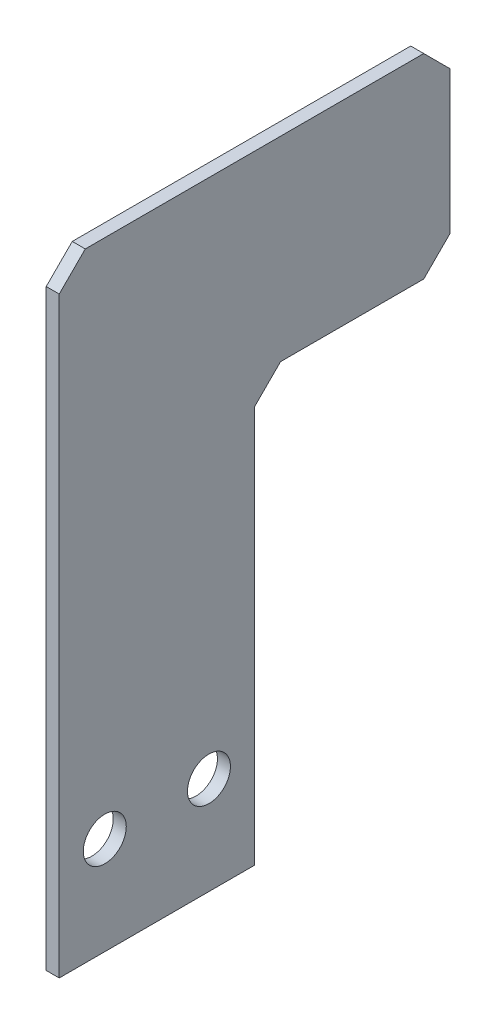
from build123d import *

# Parameters (mm, degrees)
BOSS_EXTRUDE1_DEPTH = 2.54
SKETCH2_R           = 4.191
CUT_EXTRUDE1_DEPTH  = 95.508529347


with BuildPart() as part:
    # Sketch1 → Boss-Extrude1 (new body)
    with BuildSketch(Plane(origin=(0, 0, 0), x_dir=(0, 0, -1), z_dir=(1, 0, 0))):
        Polygon((21.030595238, 39.385119048), (48.970595238, 39.385119048), (54.050595238, 44.465119048), (54.050595238, 72.405119048), (48.970595238, 77.485119048), (-17.069404762, 77.485119048), (-22.149404762, 72.405119048), (-22.149404762, -43.164880952), (15.950595238, -43.164880952), (15.950595238, 34.305119048), align=None)
    extrude(amount=BOSS_EXTRUDE1_DEPTH)

    # Sketch2 → Cut-Extrude1 (cut, through all)
    with BuildSketch(Plane(origin=(2.54, 0, 0), x_dir=(0, 0, -1), z_dir=(1, 0, 0))):
        with Locations((-13.259404762, -24.114880952)):
            Circle(SKETCH2_R)
        with Locations((7.060595238, -24.114880952)):
            Circle(SKETCH2_R)
    extrude(amount=-CUT_EXTRUDE1_DEPTH, mode=Mode.SUBTRACT)


solid = part.part
